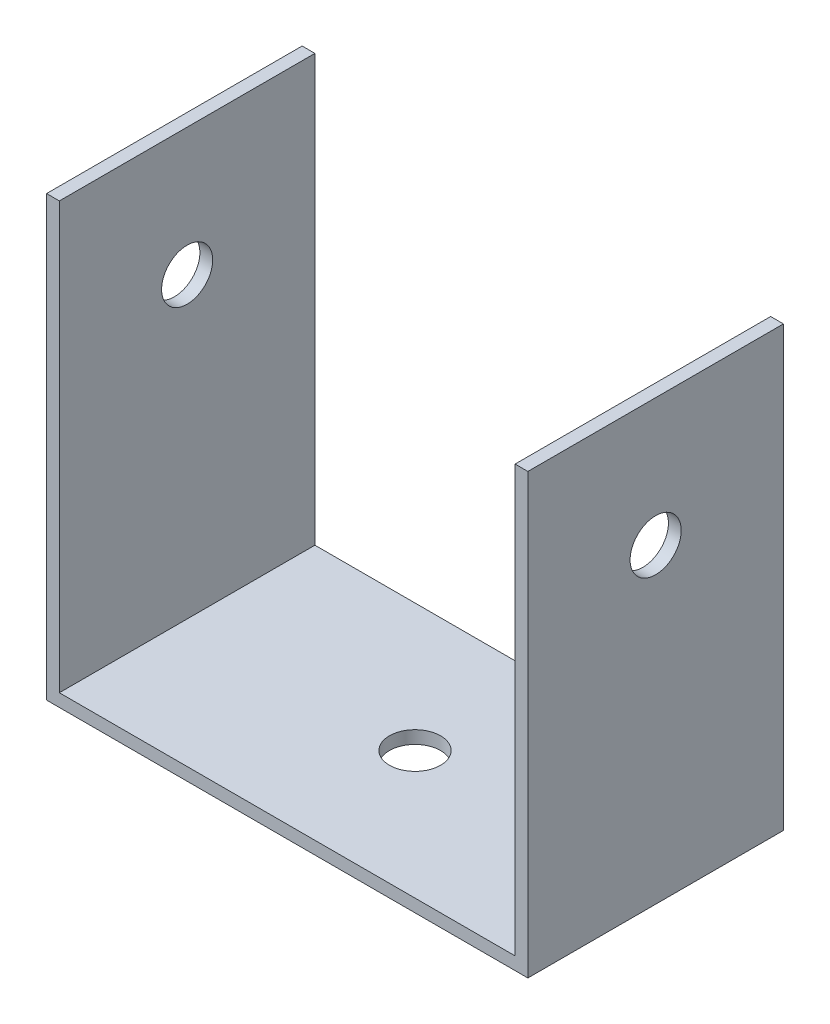
from build123d import *

# Parameters (mm, degrees)
BOSS_EXTRUDE1_DEPTH = 30
SKETCH3_R           = 3
CUT_EXTRUDE1_DEPTH  = 60
CUT_EXTRUDE2_REACH  = 66.792
SKETCH4_R           = 3


with BuildPart() as part:
    # Sketch2 → Boss-Extrude1 (new body)
    with BuildSketch(Plane.XY):
        Polygon((26.75, 0), (-26.75, 0), (-26.75, 50), (-28.25, 50), (-28.25, -1.5), (28.25, -1.5), (28.25, 50), (26.75, 50), align=None)
    extrude(amount=BOSS_EXTRUDE1_DEPTH)

    # Sketch3 → Cut-Extrude1 (cut)
    with BuildSketch(Plane.ZY.offset(28.25)):
        with Locations(Location((15, 35, 0), (0, 0, 270))):
            Circle(SKETCH3_R)
    extrude(amount=-CUT_EXTRUDE1_DEPTH, mode=Mode.SUBTRACT)

    # Sketch4 → Cut-Extrude2 (cut, up to next)
    with BuildSketch(Plane(origin=(0, 0, 0), x_dir=(1, 0, 0), z_dir=(0, 1, 0)), mode=Mode.PRIVATE) as cut_extrude2_sk1:
        with Locations(Location((0, -15, 0), (0, 0, 270))):
            Circle(SKETCH4_R)
    cut_extrude2_tool1 = extrude(cut_extrude2_sk1.sketch, amount=-CUT_EXTRUDE2_REACH, mode=Mode.PRIVATE) & part.part
    add(cut_extrude2_tool1.solids().sort_by_distance((0, 0, 15))[0], mode=Mode.SUBTRACT)


solid = part.part
